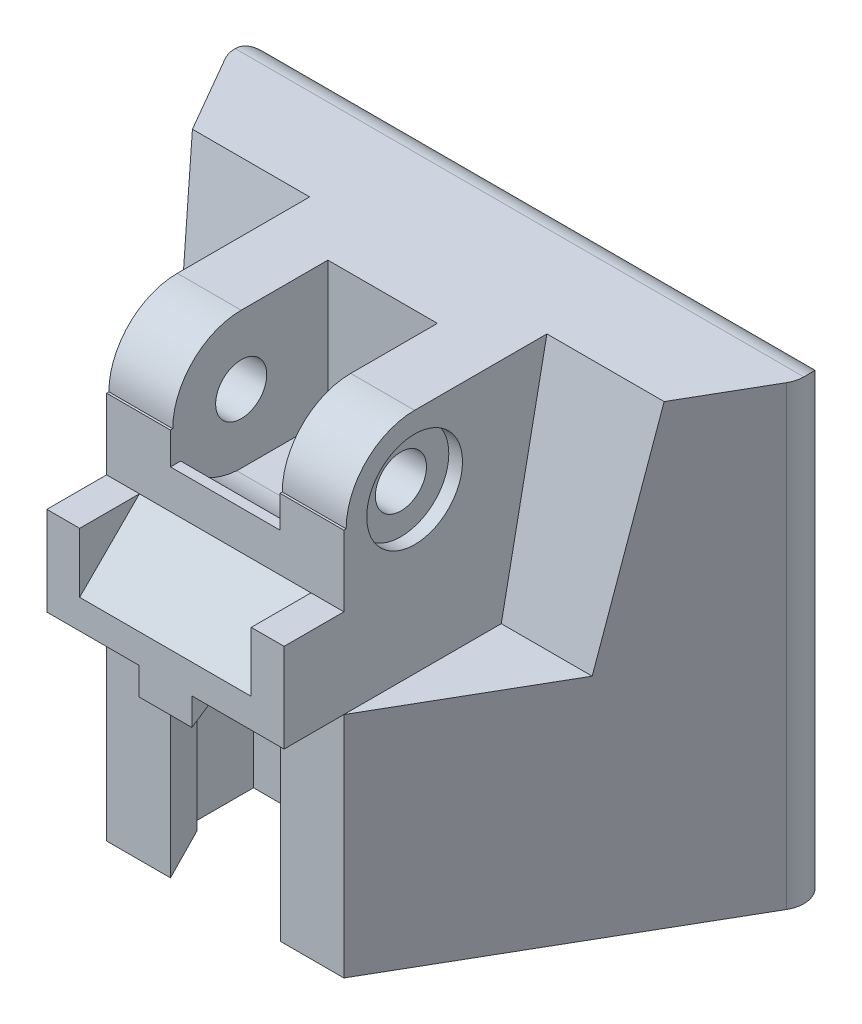
from build123d import *

# Parameters (mm, degrees)
BOSS_EXTRUDE1_DEPTH     = 50
CUT_EXTRUDE6_DEPTH      = 25
CUT_EXTRUDE3_DEPTH      = 39.00000000000001
SKETCH14_R              = 7.5000000000001545
BOSS_EXTRUDE7_DEPTH     = 7
SKETCH15_R              = 2.800000000000002
CUT_EXTRUDE4_DEPTH      = 27.999999999999996
SKETCH16_R              = 5.249999999999997
CUT_EXTRUDE5_DEPTH      = 1.5
CUT_EXTRUDE7_DEPTH      = 54.52569476429079
SKETCH19_R              = 2.1499999999999995
CUT_EXTRUDE9_DEPTH      = 50
ENL_V_MAT_EXTRU_1_DEPTH = 7.5
ENL_V_MAT_EXTRU_3_DEPTH = 10
BOSS_EXTRU_1_DEPTH      = 26.00000000000001
ENL_V_MAT_EXTRU_5_DEPTH = 3.5
BOSS_EXTRU_3_DEPTH      = 1
BOSS_EXTRU_4_START      = -5.8
BOSS_EXTRU_4_DEPTH      = 5.8
BOSS_EXTRU_5_DEPTH      = 0.1
BOSS_EXTRU_6_DEPTH      = 0.1
ESQUISSE13_W            = 6.549999999999918
ESQUISSE13_H            = 9.750000000000139
BOSS_EXTRU_7_DEPTH      = 3.6
ESQUISSE14_W            = 6.549999999999992
ESQUISSE14_H            = 9.750000000000139
BOSS_EXTRU_8_DEPTH      = 3.6
BOSS_EXTRU_11_DEPTH     = 25
BOSS_EXTRU_12_DEPTH     = 25
ENL_V_MAT_EXTRU_6_DEPTH = 28.00000000000001
CONG_1_R                = 3


with BuildPart() as part:
    # Sketch1 → Boss-Extrude1 (new body)
    with BuildSketch(Plane(origin=(0, 0, 0), x_dir=(1, 0, 0), z_dir=(0, 1, 0))):
        Polygon((-13.000000000000004, 14), (12.999999999999996, 14), (13.000000000000002, -14), (-12.999999999999998, -14), align=None)
    extrude(amount=BOSS_EXTRUDE1_DEPTH)

    # Sketch3 → Cut-Extrude6 (cut)
    with BuildSketch(Plane(origin=(0, 0, 0), x_dir=(1, 0, 0), z_dir=(0, 1, 0))):
        Polygon((9.998973293230602, 2.6500000000000012), (9.9989732932306, 9.850000000000001), (2.9002540058261537, 9.850000000000001), (2.881158297661572, 5.82281627717582), (-2.9187777922427904, 5.850044075927868), (-2.8999999999999972, 9.850000000000001), (-9.999999999999996, 9.85), (-9.999999999999995, 2.6499999999999995), (-8.99999999999974, 2.6499999999999995), (-6.00000000000001, -3.2500000000000027), (-9.999999999999998, -3.2500000000000027), (-9.999999999999993, -4.349999999999079), (-9.99999999999999, -15.089504782389637), (10.190019105374848, -15.102048820223754), (10.123266065424222, -8.899331206040385), (10.06892160658641, -3.849623622447693), (10.062468515842252, -3.2500000000000027), (6.072889948170096, -3.2500000000000027), (8.998973293230604, 2.6500000000000017), align=None)
    extrude(amount=CUT_EXTRUDE6_DEPTH, mode=Mode.SUBTRACT)

    # Sketch7 → Cut-Extrude3 (cut)
    with BuildSketch(Plane(origin=(13, 0, -2.42e-15), x_dir=(-1.3e-16, 0, -1), z_dir=(1, 0, -1.3e-16))):
        with BuildLine():
            Line((4.499999999999999, 50), (-14.000000000000002, 50))
            Line((-14.000000000000002, 50), (-14.000000000000002, 24.000000000000004))
            Line((-14.000000000000002, 24.000000000000004), (-0.8033008588991847, 37.19669914110098))
            ThreePointArc((-0.8033008588991847, 37.19669914110098), (11.429096493834622, 39.629874257261775), (4.499999999999999, 50))
        make_face()
    extrude(amount=-CUT_EXTRUDE3_DEPTH, mode=Mode.SUBTRACT)

    # Sketch14 → Boss-Extrude7 (add)
    with BuildSketch(Plane(origin=(13, 0, -2.42e-15), x_dir=(-1.3e-16, 0, -1), z_dir=(1, 0, -1.3e-16))):
        with Locations((4.499999999999999, 42.500000000000114)):
            Circle(SKETCH14_R)
    boss_extrude7 = extrude(amount=-BOSS_EXTRUDE7_DEPTH)

    # Symétrie1: Boss-Extrude7 across plane
    add(boss_extrude7.mirror(Plane(origin=(0, 0, 0), x_dir=(0, 0, 1), z_dir=(1, 0, 0))))

    # Sketch15 → Cut-Extrude4 (cut)
    with BuildSketch(Plane(origin=(13, 0, -2.42e-15), x_dir=(-1.3e-16, 0, -1), z_dir=(1, 0, -1.3e-16))):
        with Locations((4.499999999999999, 42.50000000000027)):
            Circle(SKETCH15_R)
    extrude(amount=-CUT_EXTRUDE4_DEPTH, mode=Mode.SUBTRACT)

    # Sketch16 → Cut-Extrude5 (cut)
    with BuildSketch(Plane(origin=(13, 0, -2.42e-15), x_dir=(-1.3e-16, 0, -1), z_dir=(1, 0, -1.3e-16))):
        with Locations((4.499999999999999, 42.50000000000027)):
            Circle(SKETCH16_R)
    cut_extrude5 = extrude(amount=-CUT_EXTRUDE5_DEPTH, mode=Mode.SUBTRACT)

    # Mirror3: Cut-Extrude5 across plane
    add(cut_extrude5.mirror(Plane(origin=(0, 0, 0), x_dir=(0, 0, 1), z_dir=(1, 0, 0))), mode=Mode.SUBTRACT)

    # Sketch17 → Cut-Extrude7 (cut, through all)
    with BuildSketch(Plane.XZ):
        Polygon((-9.29999999999996, 3.250000000000054), (-13.000000000000009, 3.2500000000000546), (-12.999999999999998, 14), (13.000000000000002, 14), (12.99999999999999, 3.2500000000000546), (9.300000000000033, 3.2499999999999205), (9.300000000000033, 9.79999999999992), (-9.29999999999996, 9.80000000000005), align=None)
    extrude(amount=-CUT_EXTRUDE7_DEPTH, mode=Mode.SUBTRACT)

    # Sketch19 → Cut-Extrude9 (cut)
    with BuildSketch(Plane(origin=(0, 0, -14), x_dir=(-1, 0, 0), z_dir=(0, 0, -1))):
        with Locations((0, 15)):
            Circle(SKETCH19_R)
    extrude(amount=-CUT_EXTRUDE9_DEPTH, mode=Mode.SUBTRACT)

    # Esquisse1 → Enlèv. mat.-Extru.1 (cut)
    with BuildSketch(Plane(origin=(0, 50, 0), x_dir=(1, 0, 0), z_dir=(0, 1, 0))):
        Polygon((5.999999999999998, 4.500000000000001), (-6.000000000000002, 4.499999999999999), (-6, 14), (5.999999999999998, 14), align=None)
    extrude(amount=-ENL_V_MAT_EXTRU_1_DEPTH, mode=Mode.SUBTRACT)

    # Esquisse3 → Enlèv. mat.-Extru.3 (cut)
    with BuildSketch(Plane(origin=(0, 0, -14), x_dir=(-1, 0, 0), z_dir=(0, 0, -1))):
        Polygon((6, 42.5), (-6, 42.5), (-5.999999999999999, 35), (6.000000000000001, 35), align=None)
    extrude(amount=-ENL_V_MAT_EXTRU_3_DEPTH, mode=Mode.SUBTRACT)

    # Esquisse6 → Boss.-Extru.1 (add)
    with BuildSketch(Plane(origin=(13, 0, -2.42e-15), x_dir=(-1.9e-16, 0, -1), z_dir=(1, 0, -1.9e-16))):
        with BuildLine():
            Line((-3.2500000000000573, 34.75000000000014), (-3.2500000000000573, 42.50000000000006))
            Line((-3.2500000000000573, 42.50000000000006), (-3.0000000000000226, 42.50000000000006))
            ThreePointArc((-3.0000000000000226, 42.50000000000006), (-2.4290964938347503, 39.629874257261875), (-0.8033008588992404, 37.19669914110092))
            Line((-0.8033008588992404, 37.19669914110092), (-3.2500000000000573, 34.75000000000014))
        make_face()
    extrude(amount=-BOSS_EXTRU_1_DEPTH)

    # Esquisse7 → Enlèv. mat.-Extru.5 (cut)
    with BuildSketch(Plane(origin=(0, 42.50000000000006, 0), x_dir=(1, 0, 0), z_dir=(0, 1, 0))):
        Polygon((5.999999999999993, -3.0000000000000213), (5.999999999999993, -7.096354864410982), (-6.000000000000002, -3.7800697907913037), (-6.000000000000002, 8.456914552722129), align=None)
    extrude(amount=-ENL_V_MAT_EXTRU_5_DEPTH, mode=Mode.SUBTRACT)

    # Esquisse9 → Boss.-Extru.3 (add)
    with BuildSketch(Plane(origin=(0, 25, 0), x_dir=(-1, 0, 0), z_dir=(0, -1, 0))):
        Polygon((2.899999999999959, -9.80000000000005), (-2.9000000000000408, -9.80000000000005), (-2.9000000000000408, -6.8000000000000504), (2.899999999999959, -6.80000000000005), align=None)
    extrude(amount=BOSS_EXTRU_3_DEPTH)

    # Esquisse10 → Boss.-Extru.4 (add)
    with BuildSketch(Plane.ZY.offset(2.899999999999959).offset(BOSS_EXTRU_4_START)):
        Polygon((9.80000000000005, 24), (9.80000000000005, 22), (6.80000000000005, 24), align=None)
    extrude(amount=BOSS_EXTRU_4_DEPTH)

    # Esquisse11 → Boss.-Extru.5 (add)
    with BuildSketch(Plane.ZY.offset(9.29999999999996)):
        Polygon((3.2500000000000586, 34.75000000000014), (9.80000000000005, 28.20000000000007), (9.80000000000005, 25), (3.2500000000000586, 25), align=None)
    extrude(amount=BOSS_EXTRU_5_DEPTH)

    # Esquisse12 → Boss.-Extru.6 (add)
    with BuildSketch(Plane(origin=(9.300000000000033, 0, 0), x_dir=(0, 0, -1), z_dir=(1, 0, 0))):
        Polygon((-9.79999999999992, 25), (-9.799999999999923, 28.20000000000013), (-3.250000000000055, 34.75000000000014), (-3.2499999999999205, 25), align=None)
    extrude(amount=BOSS_EXTRU_6_DEPTH)

    # Esquisse13 → Boss.-Extru.7 (add)
    with BuildSketch(Plane(origin=(9.400000000000032, 0, 0), x_dir=(0, 0, -1), z_dir=(1, 0, 0))):
        with Locations((-6.524999999999961, 29.87500000000007)):
            Rectangle(ESQUISSE13_W, ESQUISSE13_H)
    extrude(amount=BOSS_EXTRU_7_DEPTH)

    # Esquisse14 → Boss.-Extru.8 (add)
    with BuildSketch(Plane.ZY.offset(9.39999999999996)):
        with Locations((6.5250000000000545, 29.87500000000007)):
            Rectangle(ESQUISSE14_W, ESQUISSE14_H)
    extrude(amount=BOSS_EXTRU_8_DEPTH)

    # Esquisse18 → Boss.-Extru.11 (add)
    with BuildSketch(Plane.XZ):
        Polygon((-13.000000000000009, 3.2500000000000524), (-33.35159698893457, -32), (33.35159698893456, -32), (12.99999999999999, 3.2500000000000546), (12.999999999999996, -14), (-13.000000000000004, -14), align=None)
    extrude(amount=-BOSS_EXTRU_11_DEPTH)

    # Esquisse19 → Boss.-Extru.12 (add)
    with BuildSketch(Plane(origin=(0, 25, 0), x_dir=(1, 0, 0), z_dir=(0, 1, 0))):
        Polygon((33.35159698893456, 32), (22.959292143521182, 14.000000000000002), (-22.95929214352119, 14), (-33.35159698893457, 32), align=None)
    extrude(amount=BOSS_EXTRU_12_DEPTH)

    # Esquisse20 → Enlèv. mat.-Extru.6 (cut)
    with BuildSketch(Plane(origin=(13, 0, -2.42e-15), x_dir=(-1.9e-16, 0, -1), z_dir=(1, 0, -1.9e-16))):
        Polygon((14, 25), (14, 50), (19, 50), align=None)
    enl_v_mat_extru_6 = extrude(amount=ENL_V_MAT_EXTRU_6_DEPTH, mode=Mode.SUBTRACT)

    # Symétrie3: Enlèv. mat.-Extru.6 across plane
    add(enl_v_mat_extru_6.mirror(Plane(origin=(0, 0, 0), x_dir=(0, 0, 1), z_dir=(1, 0, 0))), mode=Mode.SUBTRACT)

    # Congé1
    cong_1_edges = [part.edges().sort_by_distance(p)[0] for p in [
        (33.35159698893456, 25, -32),
        (-33.35159698893457, 25, -32),
        (-7.11e-15, 50, -32),
    ]]
    fillet(cong_1_edges, radius=CONG_1_R)


solid = part.part
